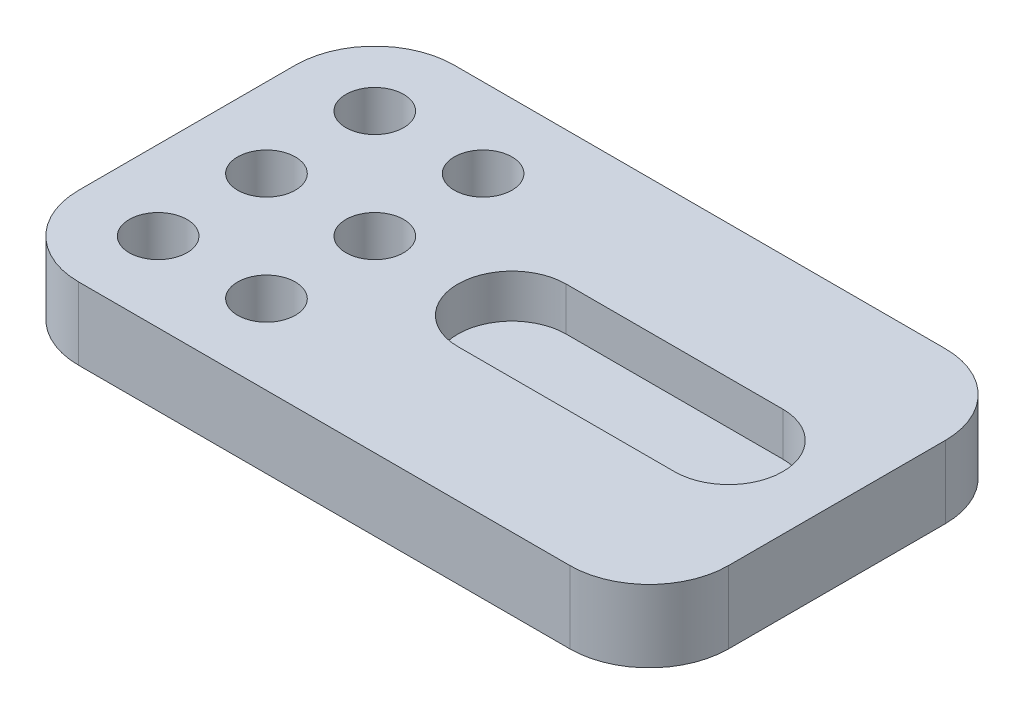
from build123d import *

# Parameters (mm, degrees)
SKETCH1_W           = 180
SKETCH1_H           = 104
BOSS_EXTRUDE1_DEPTH = 20
FILLET1_R           = 22
SKETCH3_R           = 8
CUT_EXTRUDE1_DEPTH  = 20
CUT_EXTRUDE2_DEPTH  = 12


with BuildPart() as part:
    # Sketch1 → Boss-Extrude1 (new body)
    with BuildSketch(Plane(origin=(0, 0, 0), x_dir=(1, 0, 0), z_dir=(0, 1, 0))):
        Rectangle(SKETCH1_W, SKETCH1_H)
    extrude(amount=BOSS_EXTRUDE1_DEPTH)

    # Fillet1
    fillet1_edges = [part.edges().sort_by_distance(p)[0] for p in [
        (90, 10, 52),
        (-90, 10, 52),
        (-90, 10, -52),
        (90, 10, -52),
    ]]
    fillet(fillet1_edges, radius=FILLET1_R)

    # Sketch3 → Cut-Extrude1 (cut)
    with BuildSketch(Plane(origin=(0, 20, 0), x_dir=(1, 0, 0), z_dir=(0, 1, 0))):
        with Locations(Location((-68, 30, 0), (0, 0, 270))):
            Circle(SKETCH3_R)
        with Locations(Location((-68, 0, 0), (0, 0, 270))):
            Circle(SKETCH3_R)
        with Locations(Location((-68, -30, 0), (0, 0, 270))):
            Circle(SKETCH3_R)
        with Locations(Location((-38, -30, 0), (0, 0, 270))):
            Circle(SKETCH3_R)
        with Locations(Location((-38, 0, 0), (0, 0, 270))):
            Circle(SKETCH3_R)
        with Locations(Location((-38, 30, 0), (0, 0, 270))):
            Circle(SKETCH3_R)
    extrude(amount=-CUT_EXTRUDE1_DEPTH, mode=Mode.SUBTRACT)

    # Sketch4 → Cut-Extrude2 (cut)
    with BuildSketch(Plane(origin=(0, 20, 0), x_dir=(1, 0, 0), z_dir=(0, 1, 0))):
        with BuildLine():
            Line((0, 15), (60, 15))
            ThreePointArc((60, 15), (75, 0), (60, -15))
            Line((60, -15), (0, -15))
            ThreePointArc((0, -15), (-15, 0), (0, 15))
        make_face()
    extrude(amount=-CUT_EXTRUDE2_DEPTH, mode=Mode.SUBTRACT)


solid = part.part
